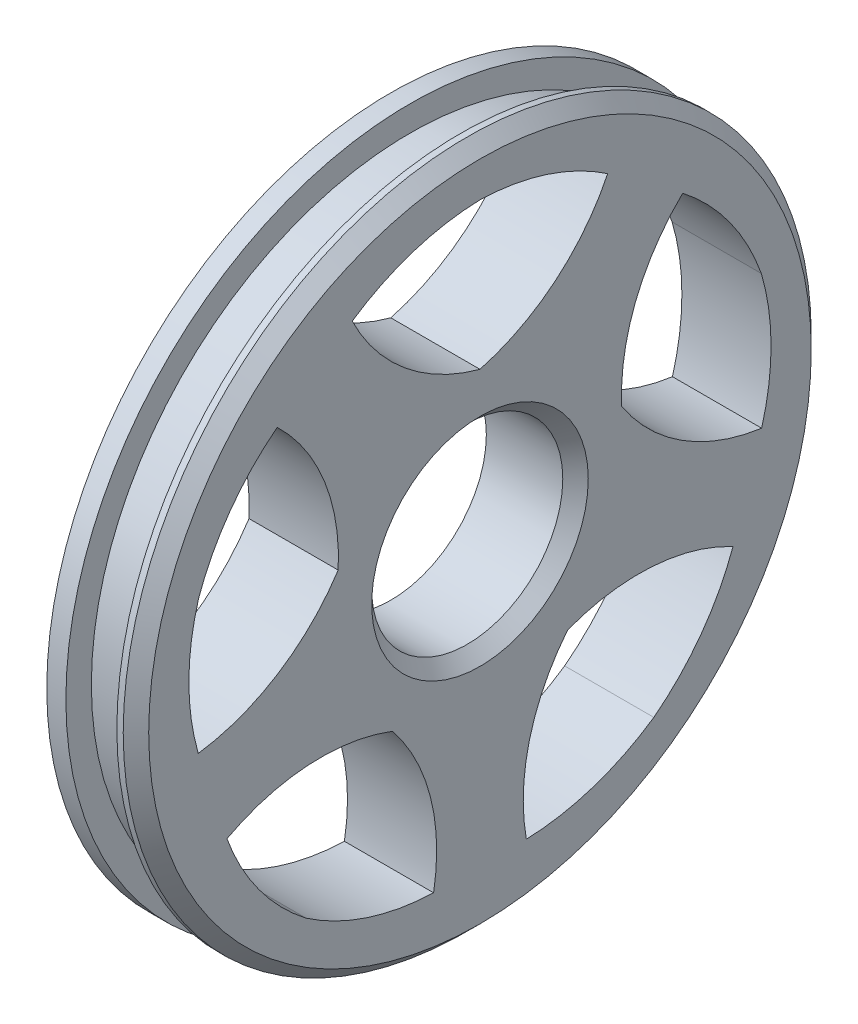
from build123d import *

# Parameters (mm, degrees)
SKETCH1_R           = 13.5
SKETCH1_R_2         = 3.75
BOSS_EXTRUDE1_DEPTH = 1.75
CUT_EXTRUDE1_DEPTH  = 20.17191957
CIRPATTERN1_COUNT   = 5
CHAMFER1_SIZE       = 0.5
SKETCH4_R           = 13.5
SKETCH4_R_2         = 12.5
CUT_EXTRUDE3_DEPTH  = 1


with BuildPart() as part:
    # Sketch1 → Boss-Extrude1 (new, symmetric)
    with BuildSketch(Plane(origin=(0, 0, 0), x_dir=(0, 0, -1), z_dir=(1, 0, 0))):
        Circle(SKETCH1_R)
        Circle(SKETCH1_R_2, mode=Mode.SUBTRACT)
    extrude(amount=BOSS_EXTRUDE1_DEPTH, both=True)

    # Sketch2 → Cut-Extrude1 (cut, symmetric)
    with BuildSketch(Plane(origin=(0, 0, 0), x_dir=(0, 0, -1), z_dir=(1, 0, 0))):
        with BuildLine():
            ThreePointArc((0, 5.849695328), (-2.956289657, 7.377375059), (-5.012219469, 9.99397715))
            ThreePointArc((-5.012219469, 9.99397715), (-2.621563936, 11.159720287), (0, 11.6087119))
            ThreePointArc((0, 11.6087119), (2.621563936, 11.159720287), (5.012219469, 9.99397715))
            ThreePointArc((5.012219469, 9.99397715), (2.956289657, 7.377375059), (0, 5.849695328))
        make_face()
    cut_extrude1 = extrude(amount=CUT_EXTRUDE1_DEPTH, both=True, mode=Mode.SUBTRACT)

    # CirPattern1: Cut-Extrude1 ×5 about axis
    cirpattern1_axis = Axis((0, 0, 0), (1, 0, 0))
    for i in range(1, CIRPATTERN1_COUNT):
        add(cut_extrude1.rotate(cirpattern1_axis, i * 360 / CIRPATTERN1_COUNT), mode=Mode.SUBTRACT)

    # Chamfer1
    chamfer1_edges = [part.edges().sort_by_distance(p)[0] for p in [
        (1.75, 0, 13.5),
        (1.75, 0, 3.75),
    ]]
    chamfer(chamfer1_edges, length=CHAMFER1_SIZE)

    # Sketch4 → Cut-Extrude3 (cut, symmetric)
    with BuildSketch(Plane(origin=(0, 0, 0), x_dir=(0, 0, -1), z_dir=(1, 0, 0))):
        Circle(SKETCH4_R)
        Circle(SKETCH4_R_2, mode=Mode.SUBTRACT)
    extrude(amount=CUT_EXTRUDE3_DEPTH, both=True, mode=Mode.SUBTRACT)


solid = part.part
